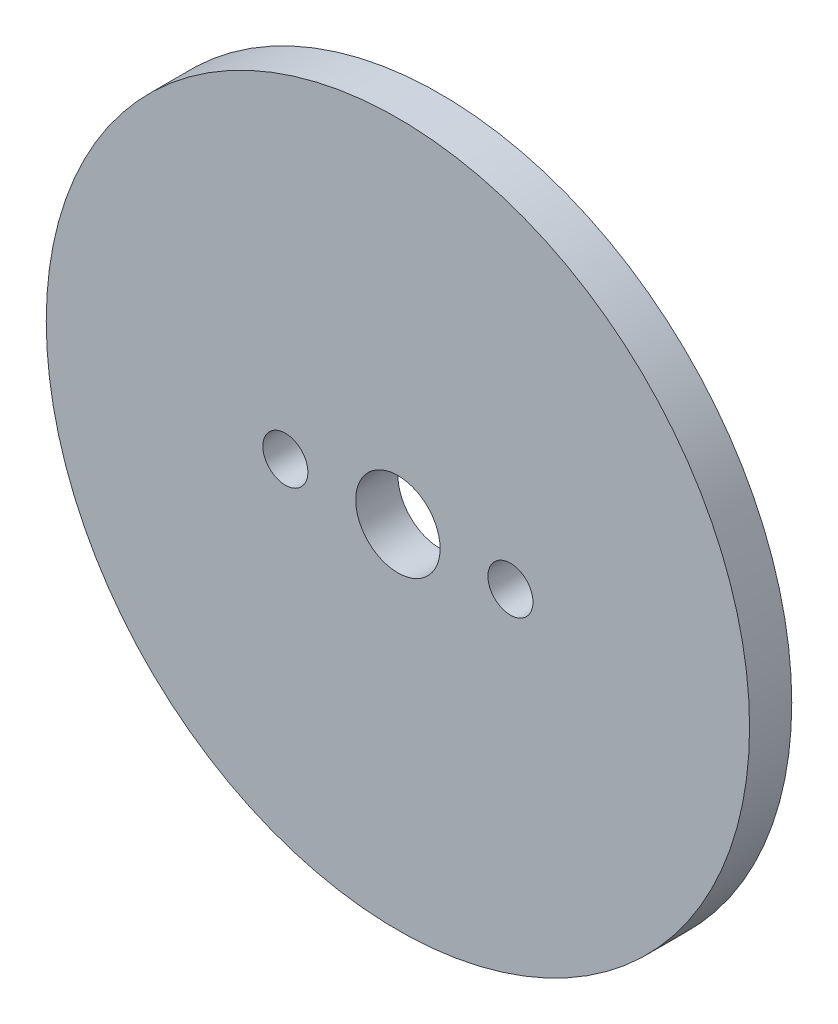
from build123d import *

# Parameters (mm, degrees)
ESBO_O1_R                = 25
ESBO_O1_R_2              = 3
ESBO_O1_R_3              = 1.6
RESSALTO_EXTRUS_O1_DEPTH = 1.5


with BuildPart() as part:
    # Esboço1 → Ressalto-extrusão1 (new, symmetric)
    with BuildSketch(Plane.XY):
        Circle(ESBO_O1_R)
        Circle(ESBO_O1_R_2, mode=Mode.SUBTRACT)
        with Locations((-8, 0)):
            Circle(ESBO_O1_R_3, mode=Mode.SUBTRACT)
        with Locations((8, 0)):
            Circle(ESBO_O1_R_3, mode=Mode.SUBTRACT)
    extrude(amount=RESSALTO_EXTRUS_O1_DEPTH, both=True)


solid = part.part
